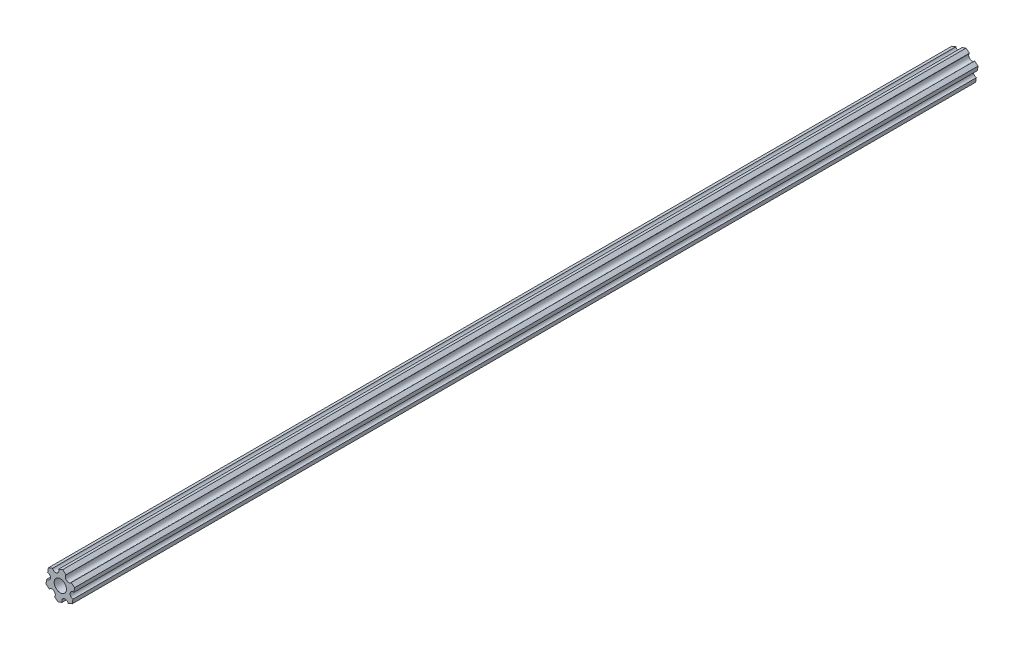
from build123d import *

# Parameters (mm, degrees)
SKETCH1_R           = 2.9337
BOSS_EXTRUDE1_DEPTH = 431.8


with BuildPart() as part:
    # Sketch1 → Boss-Extrude1 (new body)
    with BuildSketch(Plane.XY):
        with BuildLine():
            Line((-3.766106333, 5.353419406), (-5.705543758, 4.605442841))
            Line((-5.705543758, 4.605442841), (-6.027495763, 2.551852479))
            ThreePointArc((-6.027495763, 2.551852479), (-4.7050298, 0.737631909), (-6.519250369, -0.584834054))
            Line((-6.519250369, -0.584834054), (-6.841202375, -2.638424416))
            Line((-6.841202375, -2.638424416), (-5.223716955, -3.944038213))
            ThreePointArc((-5.223716955, -3.944038213), (-2.991322872, -3.705859378), (-2.753144037, -5.938253461))
            Line((-2.753144037, -5.938253461), (-1.135658617, -7.243867257))
            Line((-1.135658617, -7.243867257), (0.803778808, -6.495890692))
            ThreePointArc((0.803778808, -6.495890692), (1.713706928, -4.443491287), (3.766106333, -5.353419406))
            Line((3.766106333, -5.353419406), (5.705543758, -4.605442841))
            Line((5.705543758, -4.605442841), (6.027495763, -2.551852479))
            ThreePointArc((6.027495763, -2.551852479), (4.7050298, -0.737631909), (6.519250369, 0.584834054))
            Line((6.519250369, 0.584834054), (6.841202375, 2.638424416))
            Line((6.841202375, 2.638424416), (5.223716955, 3.944038213))
            ThreePointArc((5.223716955, 3.944038213), (2.991322872, 3.705859378), (2.753144037, 5.938253461))
            Line((2.753144037, 5.938253461), (1.135658617, 7.243867257))
            Line((1.135658617, 7.243867257), (-0.803778808, 6.495890692))
            ThreePointArc((-0.803778808, 6.495890692), (-1.713706928, 4.443491287), (-3.766106333, 5.353419406))
        make_face()
        Circle(SKETCH1_R, mode=Mode.SUBTRACT)
    extrude(amount=BOSS_EXTRUDE1_DEPTH)


solid = part.part
